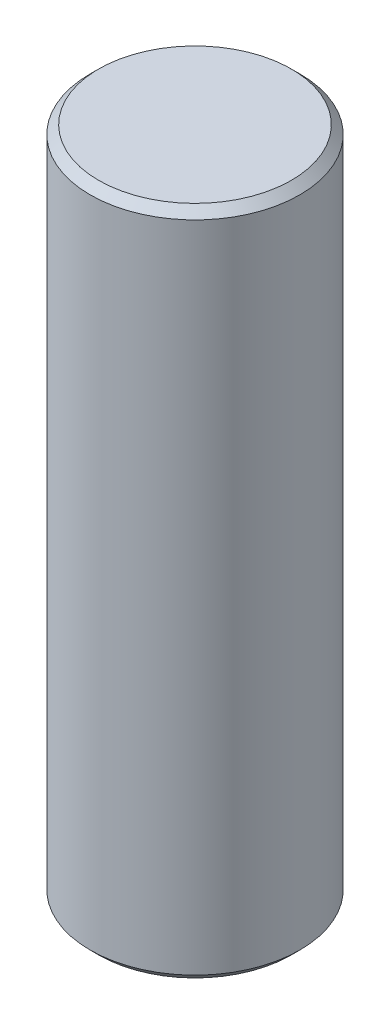
from build123d import *

# Parameters (mm, degrees)
SKETCH1_R           = 2.5
BOSS_EXTRUDE1_DEPTH = 8
CHAMFER1_SIZE       = 0.2


with BuildPart() as part:
    # Sketch1 → Boss-Extrude1 (new, symmetric)
    with BuildSketch(Plane(origin=(0, 0, 0), x_dir=(1, 0, 0), z_dir=(0, 1, 0))):
        with Locations(Location((0, 0, 0), (0, 0, 270))):
            Circle(SKETCH1_R)
    extrude(amount=BOSS_EXTRUDE1_DEPTH, both=True)

    # Chamfer1
    chamfer1_edges = [part.edges().sort_by_distance(p)[0] for p in [
        (0, -8, -2.5),
        (0, 8, -2.5),
    ]]
    chamfer(chamfer1_edges, length=CHAMFER1_SIZE)


solid = part.part
